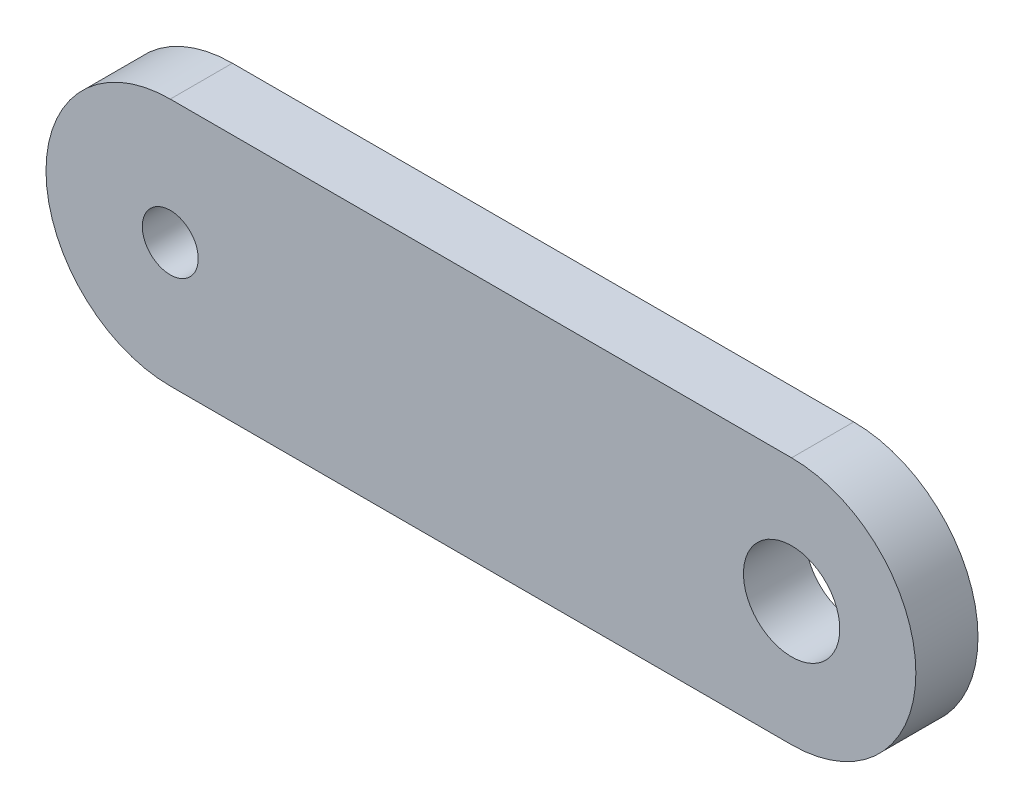
from build123d import *

# Parameters (mm, degrees)
SKETCH_1_R      = 1.55
SKETCH_1_R_2    = 0.9
EXTRUDE_1_DEPTH = 2


with BuildPart() as part:
    # 草图1 → 凸台-拉伸1 (new body)
    with BuildSketch(Plane.XY):
        with BuildLine():
            Line((10, -4), (-10, -4))
            ThreePointArc((-10, -4), (-14, 0), (-10, 4))
            Line((-10, 4), (10, 4))
            ThreePointArc((10, 4), (14, 0), (10, -4))
        make_face()
        with Locations((10, 0)):
            Circle(SKETCH_1_R, mode=Mode.SUBTRACT)
        with Locations((-10, 0)):
            Circle(SKETCH_1_R_2, mode=Mode.SUBTRACT)
    extrude(amount=EXTRUDE_1_DEPTH)


solid = part.part
